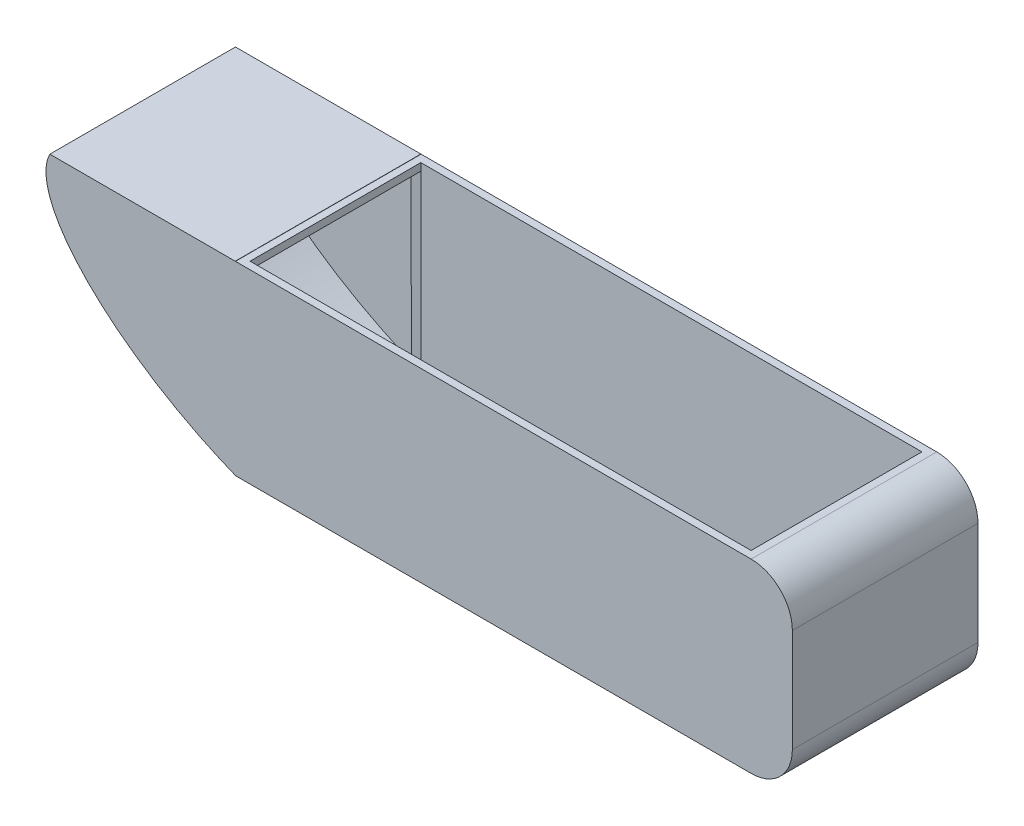
from build123d import *

# Parameters (mm, degrees)
BOSS_EXTRU_1_DEPTH      = 250
ESQUISSE2_W             = 674.796104683
ESQUISSE2_H             = 230
ENL_V_MAT_EXTRU_1_DEPTH = 240
ESQUISSE3_W             = 230
ESQUISSE3_H             = 230
ENL_V_MAT_EXTRU_2_DEPTH = 40
ENL_V_MAT_EXTRU_2_DRAFT = -66
ENL_V_START             = -10
ENL_V_MAT_EXTRU_6_DEPTH = 230
ESQUISSE7_W             = 230
ESQUISSE7_H             = 230
ENL_V_MAT_EXTRU_7_DEPTH = 20
ENL_V_MAT_EXTRU_7_DRAFT = -20


with BuildPart() as part:
    # Esquisse1 → Boss.-Extru.1 (new body)
    with BuildSketch(Plane.XY):
        with BuildLine():
            add(Edge.make_bspline(
                [(0, 0.133886157), (0.167402546, 0.066889297), (0.334804949, 0)],
                knots=[1.771746973, 1.771746973, 1.771746973, 1.773247838, 1.773247838, 1.773247838], degree=2, weights=[0.999377636, 0.999688554, 1]))
            Line((0.334804949, 0), (694.461299734, 0))
            ThreePointArc((694.461299734, 0), (733.73309131, 16.26690869), (750, 55.538700266))
            Line((750, 55.538700266), (750, 194.461299734))
            ThreePointArc((750, 194.461299734), (733.73309131, 233.73309131), (694.461299734, 250))
            Line((694.461299734, 250), (0, 250))
            Line((0, 250), (0, 249.866113843))
            add(Edge.make_bspline(
                [(0, 249.866113843), (-0.167402546, 249.933110703), (-0.334804949, 250)],
                knots=[4.913528271, 4.913528271, 4.913528271, 4.914840492, 4.914840492, 4.914840492], degree=2, weights=[1, 0.999999785, 1]))
            Line((-0.334804949, 250), (-250, 250))
            add(Edge.make_bspline(
                [(-250, 250), (-312.416343553, 125.167312895), (0, 0.133886157)],
                knots=[0, 0, 0, 1.771746973, 1.771746973, 1.771746973], degree=2, weights=[1, 0.632343338, 0.999377636]))
        make_face()
    extrude(amount=BOSS_EXTRU_1_DEPTH)

    # Esquisse2 → Enlèv. mat.-Extru.1 (cut)
    with BuildSketch(Plane(origin=(0, 250, 0), x_dir=(1, 0, 0), z_dir=(0, 1, 0))):
        with Locations((347.063247392, -125)):
            Rectangle(ESQUISSE2_W, ESQUISSE2_H)
    extrude(amount=-ENL_V_MAT_EXTRU_1_DEPTH, mode=Mode.SUBTRACT)


with BuildPart() as enl_v_mat_extru_2_tool:
    # Esquisse3 → Enlèv. mat.-Extru.2 (with draft: the straight prism first)
    with BuildSketch(Plane.ZY.offset(-684.461299734)):
        with Locations((125, 125)):
            Rectangle(ESQUISSE3_W, ESQUISSE3_H)
    extrude(amount=-ENL_V_MAT_EXTRU_2_DEPTH)
    # Enlèv. mat.-Extru.2: the draft: its side faces are tilted about the plane it starts from
    enl_v_mat_extru_2_sides = [enl_v_mat_extru_2_tool.faces().sort_by_distance(p)[0] for p in [
        (704.461299734, 125, 10),
        (704.461299734, 10, 125),
        (704.461299734, 125, 240),
        (704.461299734, 240, 125),
    ]]
    draft(enl_v_mat_extru_2_sides, Plane.ZY.offset(-684.461299734), ENL_V_MAT_EXTRU_2_DRAFT)


with BuildPart() as part_1:
    add(part.part)

    # Enlèv. mat.-Extru.2: cut by enl_v_mat_extru_2_tool
    add(enl_v_mat_extru_2_tool.part, mode=Mode.SUBTRACT)

    # Esquisse5 → Enlèv. mat.-Extru.6 (cut)
    with BuildSketch(Plane.XY.offset(250).offset(ENL_V_START)):
        with BuildLine():
            Line((0.013392186, 240.000008968), (0.321682976, 9.798221826))
            add(Edge.make_bspline(
                [(-243.578112703, 240.000000104), (-281.360738576, 124.899105152), (0.321682976, 9.798221826)],
                knots=[0.057124258, 0.057124258, 0.057124258, 1.763084739, 1.763084739, 1.763084739], degree=2, weights=[1, 0.657741222, 1]))
            Line((-243.578112703, 240.000000104), (0.013392186, 240.000008968))
        make_face()
    extrude(amount=-ENL_V_MAT_EXTRU_6_DEPTH, mode=Mode.SUBTRACT)


with BuildPart() as enl_v_mat_extru_7_tool:
    # Esquisse7 → Enlèv. mat.-Extru.7 (with draft: the straight prism first)
    with BuildSketch(Plane(origin=(9.665195051, 0, 0), x_dir=(0, 0, -1), z_dir=(1, 0, 0))):
        with Locations((-125, 125)):
            Rectangle(ESQUISSE7_W, ESQUISSE7_H)
    extrude(amount=-ENL_V_MAT_EXTRU_7_DEPTH)
    # Enlèv. mat.-Extru.7: the draft: its side faces are tilted about the plane it starts from
    enl_v_mat_extru_7_sides = [enl_v_mat_extru_7_tool.faces().sort_by_distance(p)[0] for p in [
        (-0.334804949, 125, 10),
        (-0.334804949, 240, 125),
        (-0.334804949, 125, 240),
        (-0.334804949, 10, 125),
    ]]
    draft(enl_v_mat_extru_7_sides, Plane(origin=(9.665195051, 0, 0), x_dir=(0, 0, -1), z_dir=(1, 0, 0)), ENL_V_MAT_EXTRU_7_DRAFT)


with BuildPart() as part_2:
    add(part_1.part)

    # Enlèv. mat.-Extru.7: cut by enl_v_mat_extru_7_tool
    add(enl_v_mat_extru_7_tool.part, mode=Mode.SUBTRACT)


solid = part_2.part
